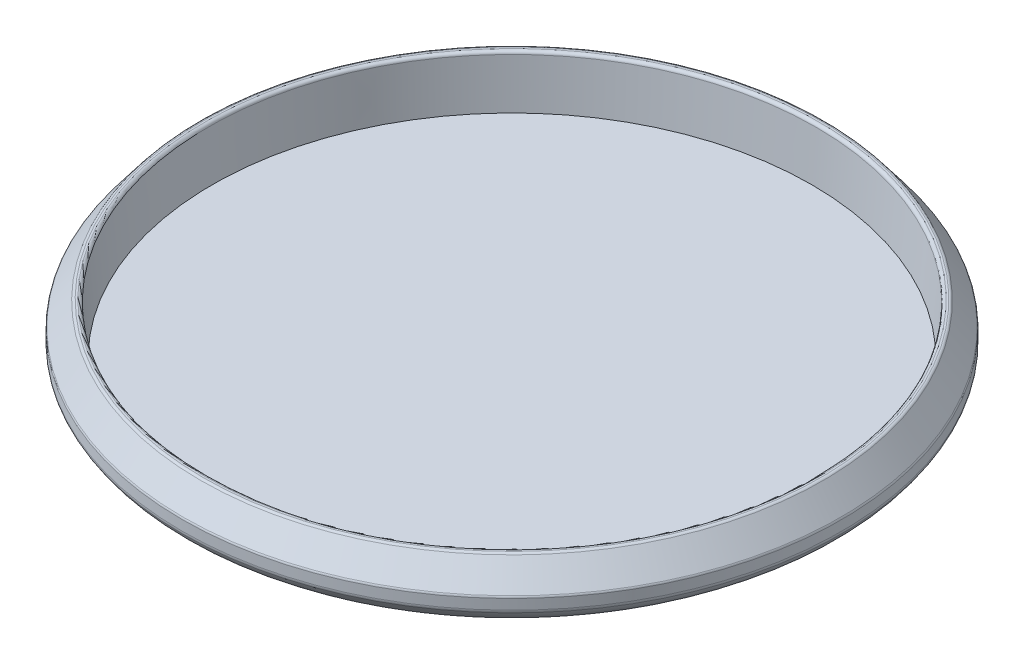
from build123d import *

# Parameters (mm, degrees)
SKETCH1_R           = 95
BOSS_EXTRUDE1_DEPTH = 1.5
FILLET1_R           = 1
FILLET2_R           = 1
FILLET4_R           = 2


with BuildPart() as part:
    # Sketch1 → Boss-Extrude1 (new body)
    with BuildSketch(Plane(origin=(0, 0, 0), x_dir=(1, 0, 0), z_dir=(0, 1, 0))):
        with Locations(Location((0, 0, 0), (0, 0, 270))):
            Circle(SKETCH1_R)
    extrude(amount=BOSS_EXTRUDE1_DEPTH)

    # Sketch2 → Revolve1 (revolve)
    with BuildSketch(Plane.XY, mode=Mode.PRIVATE) as revolve1_sk:
        with BuildLine():
            Line((95, 1.5), (96.40419305, 17.55))
            Line((96.40419305, 17.55), (98.40419305, 17.55))
            Line((98.40419305, 17.55), (104.461103858, 9.593001102))
            Line((104.461103858, 9.593001102), (104.461103858, 5.593001102))
            ThreePointArc((104.461103858, 5.593001102), (100.616111366, 1.298490869), (95, 0))
            Line((95, 0), (95, 1.5))
        make_face()
    revolve(revolve1_sk.sketch.rotate(Axis((0, 0, 0), (0, 1, 0)), 90), axis=Axis((0, 0, 0), (0, 1, 0)))

    # Fillet1
    fillet1_edges = [part.edges().sort_by_distance(p)[0] for p in [
        (0, 17.55, 98.40419305),
        (0, 17.55, 96.40419305),
    ]]
    fillet(fillet1_edges, radius=FILLET1_R)

    # Fillet2
    fillet2_edges = [part.edges().sort_by_distance(p)[0] for p in [
        (0, 9.593001102, 104.461103858),
    ]]
    fillet(fillet2_edges, radius=FILLET2_R)

    # Fillet4
    fillet4_edges = [part.edges().sort_by_distance(p)[0] for p in [
        (0, 5.593001102, 104.461103858),
    ]]
    fillet(fillet4_edges, radius=FILLET4_R)


solid = part.part
